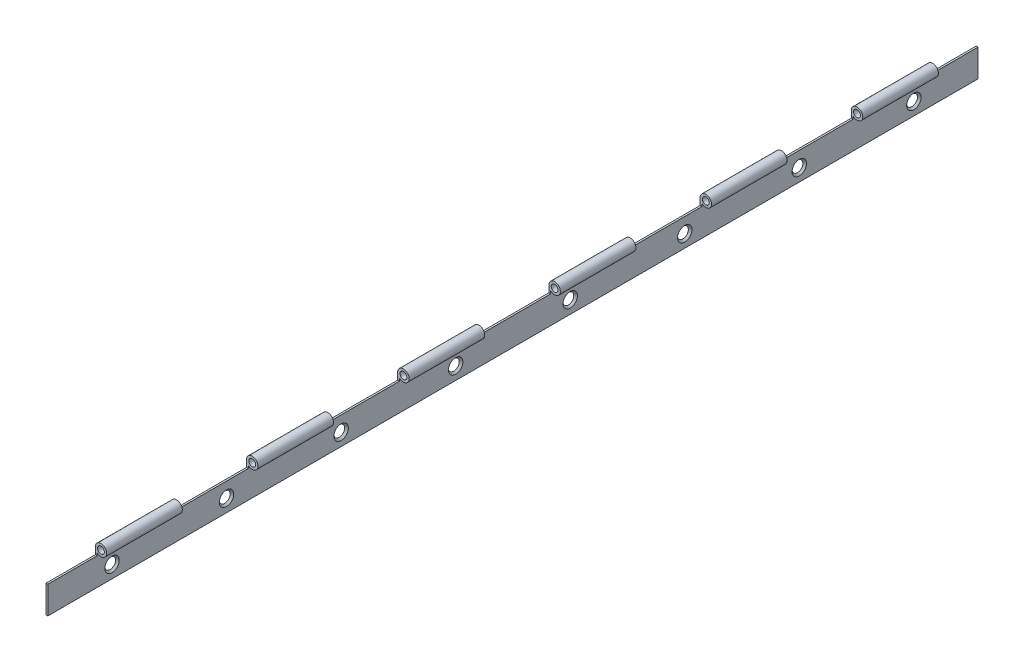
from build123d import *

# Parameters (mm, degrees)
SKETCH_1_W             = 0.8
SKETCH_1_H             = 15
EXTRUDE_1_DEPTH        = 203
SKETCH_2_R             = 2.5
SKETCH_3_R             = 1.5
CUT_EXTRUDE_1_DEPTH    = 407.407738607
SKETCH_10_W            = 33
SKETCH_10_H            = 6
SKETCH_10_W_2          = 21.5
CUT_EXTRUDE_4_DEPTH    = 60
PATTERN_LINEAR_1_COUNT = 8
PATTERN_LINEAR_1_PITCH = 50


with BuildPart() as part:
    # 草图1 → 拉伸-薄壁1 (new, symmetric)
    with BuildSketch(Plane.XY):
        with Locations((0.4, 7.5)):
            Rectangle(SKETCH_1_W, SKETCH_1_H)
    extrude(amount=EXTRUDE_1_DEPTH, both=True)

    # 扫描1: sweep along a curve in space
    with BuildLine() as sweep_1_path:
        Line((0.8, 15, 203), (0.8, 15, -203))
    # 草图2 → 扫描1 (sweep)
    with BuildSketch(Plane.XY.offset(203)):
        with Locations((2.5, 15)):
            Circle(SKETCH_2_R)
    sweep(path=sweep_1_path.line)

    # 草图3 → 切除-拉伸1 (cut, through all)
    with BuildSketch(Plane.XY.offset(203)):
        with Locations((2.5, 15)):
            Circle(SKETCH_3_R)
    extrude(amount=-CUT_EXTRUDE_1_DEPTH, mode=Mode.SUBTRACT)

    # 草图10 → 切除-拉伸4 (cut, symmetric)
    with BuildSketch(Plane(origin=(0.8, 0, 0), x_dir=(0, 0, -1), z_dir=(1, 0, 0))):
        with Locations((-132, 15)):
            Rectangle(SKETCH_10_W, SKETCH_10_H)
        with Locations((-192.25, 15)):
            Rectangle(SKETCH_10_W_2, SKETCH_10_H)
        with Locations((-66, 15.006165986)):
            Rectangle(SKETCH_10_W, SKETCH_10_H)
        with Locations((0, 15.012331973)):
            Rectangle(SKETCH_10_W, SKETCH_10_H)
        with Locations((66, 15.018497959)):
            Rectangle(SKETCH_10_W, SKETCH_10_H)
        with Locations((132, 15.024663945)):
            Rectangle(SKETCH_10_W, SKETCH_10_H)
        with Locations((192.25, 15.030829932)):
            Rectangle(SKETCH_10_W_2, SKETCH_10_H)
    extrude(amount=CUT_EXTRUDE_4_DEPTH, both=True, mode=Mode.SUBTRACT)

    # 草图11 → M3 锥坑平头螺钉的锥形沉头孔1 (revolve, cut)
    with BuildSketch(Plane(origin=(0.8, 5.5, -175), x_dir=(0, 0, -1), z_dir=(0, 1, 0))):
        Polygon((0, 0), (0, 0.8), (1.7, 0.8), (1.7, 1.45), (3.15, 0), align=None)
    hole_wizard_m3_1 = revolve(axis=Axis((7.15, 5.5, -175), (-1, 0, 0)), mode=Mode.SUBTRACT)

    # 阵列(线性)1: M3 锥坑平头螺钉的锥形沉头孔1 ×8
    with Locations(*[(0, 0, i * PATTERN_LINEAR_1_PITCH) for i in range(1, PATTERN_LINEAR_1_COUNT)]):
        add(hole_wizard_m3_1, mode=Mode.SUBTRACT)


solid = part.part
